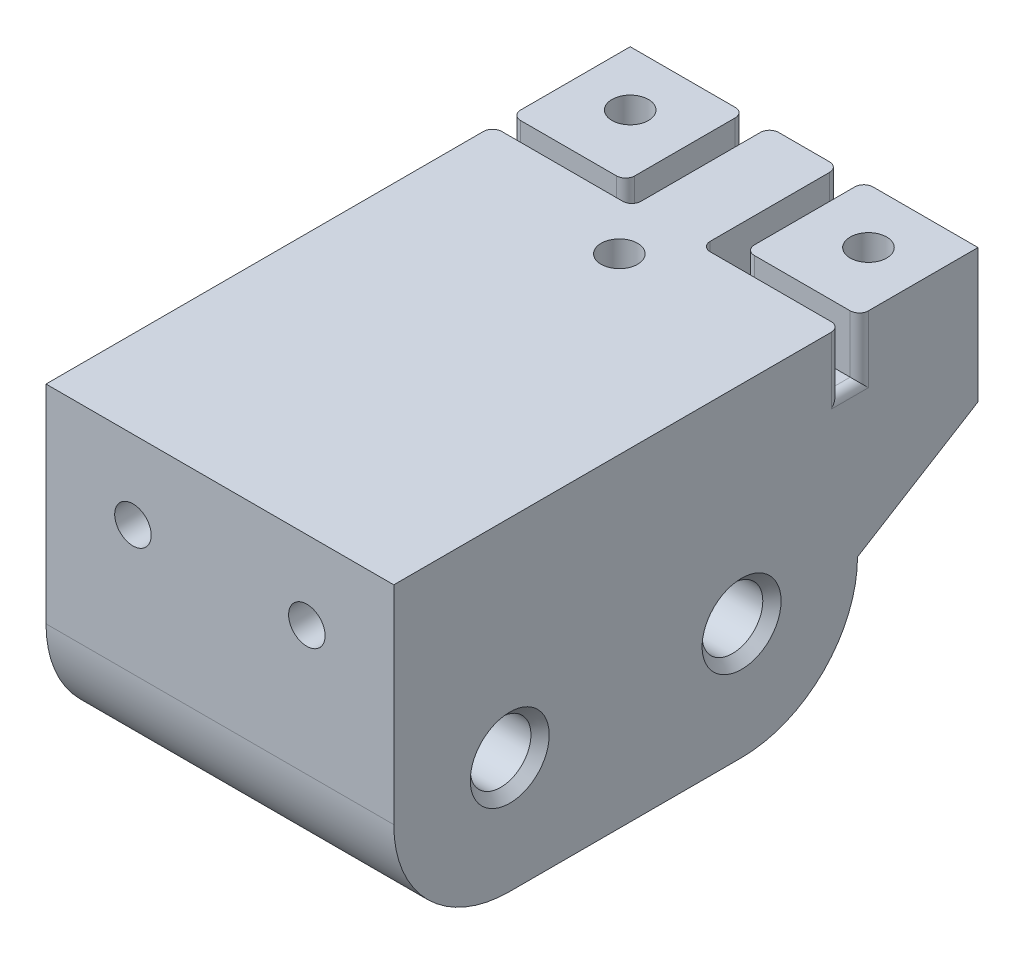
from build123d import *

# Parameters (mm, degrees)
SKETCH1_R           = 3.325
BOSS_EXTRUDE2_DEPTH = 38.1
BOSS_EXTRUDE3_REACH = 84.488
SKETCH6_W           = 38.1
SKETCH6_H           = 25.4
SKETCH10_R          = 2
CUT_EXTRUDE6_DEPTH  = 8
CHAMFER1_SIZE       = 1
CUT_EXTRUDE9_DEPTH  = 6.3
FILLET3_R           = 1
SKETCH16_R          = 2
CUT_EXTRUDE10_DEPTH = 5


with BuildPart() as part:
    # Sketch1 → Boss-Extrude2 (new body)
    with BuildSketch(Plane(origin=(0, 0, 0), x_dir=(0, 0, -1), z_dir=(1, 0, 0))):
        with BuildLine():
            Line((0, 22.75), (0, 0))
            ThreePointArc((0, 0), (12.7, -12.7), (25.4, 0))
            ThreePointArc((25.4, 0), (38.1, -12.7), (50.8, 0))
            Line((50.8, 0), (64, 8.107573416))
            Line((64, 8.107573416), (64, 22.75))
            Line((64, 22.75), (0, 22.75))
        make_face()
        with Locations(Location((38.1, 0, 0), (0, 0, 180))):
            Circle(SKETCH1_R, mode=Mode.SUBTRACT)
        with Locations(Location((12.7, 0, 0), (0, 0, 180))):
            Circle(SKETCH1_R, mode=Mode.SUBTRACT)
    extrude(amount=BOSS_EXTRUDE2_DEPTH)

    # Sketch6 → Boss-Extrude3 (add, up to next)
    with BuildSketch(Plane(origin=(0, -12.7, 0), x_dir=(-1, 0, 0), z_dir=(0, -1, 0)), mode=Mode.PRIVATE) as boss_extrude3_sk1:
        with Locations((-19.05, 25.4)):
            Rectangle(SKETCH6_W, SKETCH6_H)
    boss_extrude3_tool1 = extrude(boss_extrude3_sk1.sketch, amount=-BOSS_EXTRUDE3_REACH, mode=Mode.PRIVATE) - part.part
    add(boss_extrude3_tool1.solids().sort_by_distance((19.05, -12.7, -25.4))[0])

    # Sketch10 → Cut-Extrude6 (cut)
    with BuildSketch(Plane.XY):
        with Locations((9.525, 14.153125)):
            Circle(SKETCH10_R)
        with Locations((28.575, 14.153125)):
            Circle(SKETCH10_R)
    extrude(amount=-CUT_EXTRUDE6_DEPTH, mode=Mode.SUBTRACT)

    # Chamfer1
    chamfer1_edges = [part.edges().sort_by_distance(p)[0] for p in [
        (0, 0, -16.025),
        (0, 0, -41.425),
        (38.1, 0, -41.425),
        (38.1, 0, -16.025),
    ]]
    chamfer(chamfer1_edges, length=CHAMFER1_SIZE)

    # Sketch15 → Cut-Extrude9 (cut)
    with BuildSketch(Plane(origin=(0, 22.75, 0), x_dir=(1, 0, 0), z_dir=(0, 1, 0))):
        Polygon((12.5, 50.995), (0, 50.995), (0, 48.925), (15.26, 48.925), (15.26, 64), (12.5, 64), align=None)
        Polygon((25.6, 64), (22.84, 64), (22.84, 48.925), (38.1, 48.925), (38.1, 50.995), (25.6, 50.995), align=None)
    extrude(amount=-CUT_EXTRUDE9_DEPTH, mode=Mode.SUBTRACT)

    # Fillet3
    fillet3_edges = [part.edges().sort_by_distance(p)[0] for p in [
        (15.26, 19.6, -48.925),
        (0, 16.45, -49.96),
        (0, 19.6, -48.925),
        (0, 19.6, -50.995),
        (12.5, 19.6, -50.995),
        (13.88, 16.45, -64),
        (12.5, 19.6, -64),
        (15.26, 19.6, -64),
        (38.1, 16.45, -49.96),
        (38.1, 19.6, -50.995),
        (38.1, 19.6, -48.925),
        (22.84, 19.6, -48.925),
        (24.22, 16.45, -64),
        (22.84, 19.6, -64),
        (25.6, 19.6, -64),
        (25.6, 19.6, -50.995),
    ]]
    fillet(fillet3_edges, radius=FILLET3_R)

    # Sketch16 → Cut-Extrude10 (cut)
    with BuildSketch(Plane(origin=(0, 22.75, 0), x_dir=(1, 0, 0), z_dir=(0, 1, 0))):
        with Locations(Location((32.1, 58, 0), (0, 0, 270))):
            Circle(SKETCH16_R)
        with BuildLine():
            ThreePointArc((21.05, 43.76), (20.464213562, 45.174213562), (19.05, 45.76))
            Line((19.05, 45.76), (19.05, 41.76))
            ThreePointArc((19.05, 41.76), (20.464213562, 42.345786438), (21.05, 43.76))
        make_face()
        with BuildLine():
            Line((19.05, 41.76), (19.05, 45.76))
            ThreePointArc((19.05, 45.76), (17.05, 43.76), (19.05, 41.76))
        make_face()
        with Locations(Location((6, 58, 0), (0, 0, 270))):
            Circle(SKETCH16_R)
    extrude(amount=-CUT_EXTRUDE10_DEPTH, mode=Mode.SUBTRACT)


solid = part.part
